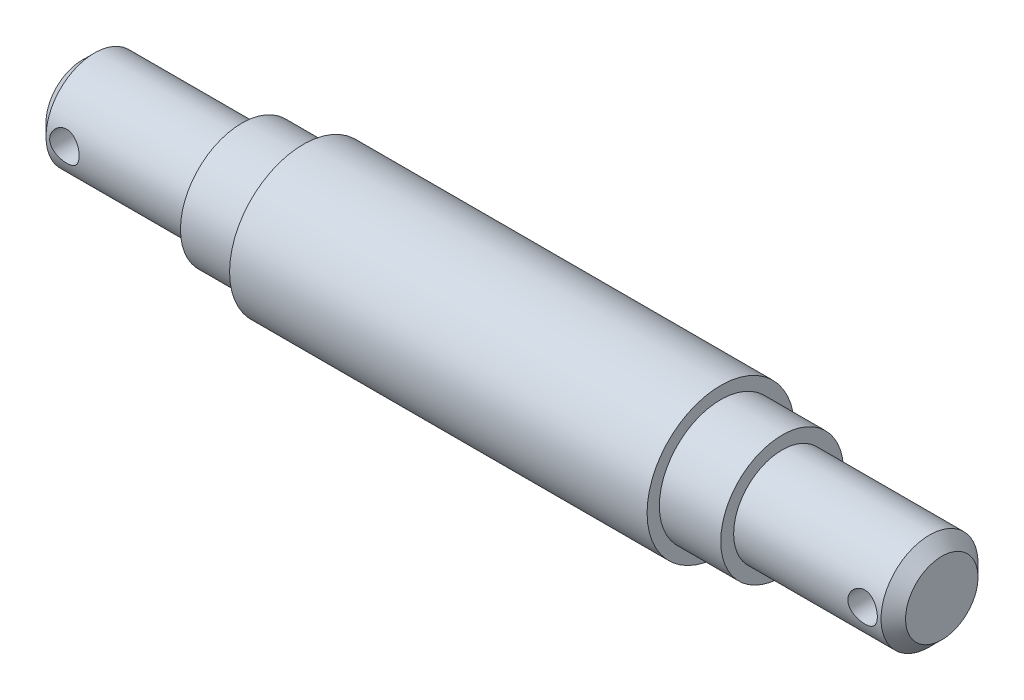
from build123d import *

# Parameters (mm, degrees)
CUT_EXTRUDE2_DEPTH      = 71.512410255
CUT_EXTRUDE2_DEPTH_BACK = 71.512410255
SKETCH5_R               = 1.2


with BuildPart() as part:
    # Sketch3 → Revolve2 (revolve)
    with BuildSketch(Plane.XY, mode=Mode.PRIVATE) as revolve2_sk:
        Polygon((0, 0), (70, 0), (70, 2.95), (69, 3.95), (57, 3.95), (57, 5), (52, 5), (52, 6), (18, 6), (18, 5), (13, 5), (13, 3.95), (1, 3.95), (0, 2.95), align=None)
    revolve(revolve2_sk.sketch.rotate(Axis((0, 0, 0), (1, 0, 0)), 90), axis=Axis((0, 0, 0), (1, 0, 0)))

    # Sketch5 → Cut-Extrude2 (cut, two sides: drawn at the far end of the back side and taken through both)
    with BuildSketch(Plane.XY.offset(-CUT_EXTRUDE2_DEPTH_BACK)):
        with Locations((2.5, 0)):
            Circle(SKETCH5_R)
        with Locations((67.5, 0)):
            Circle(SKETCH5_R)
    extrude(amount=CUT_EXTRUDE2_DEPTH + CUT_EXTRUDE2_DEPTH_BACK, mode=Mode.SUBTRACT)


solid = part.part
